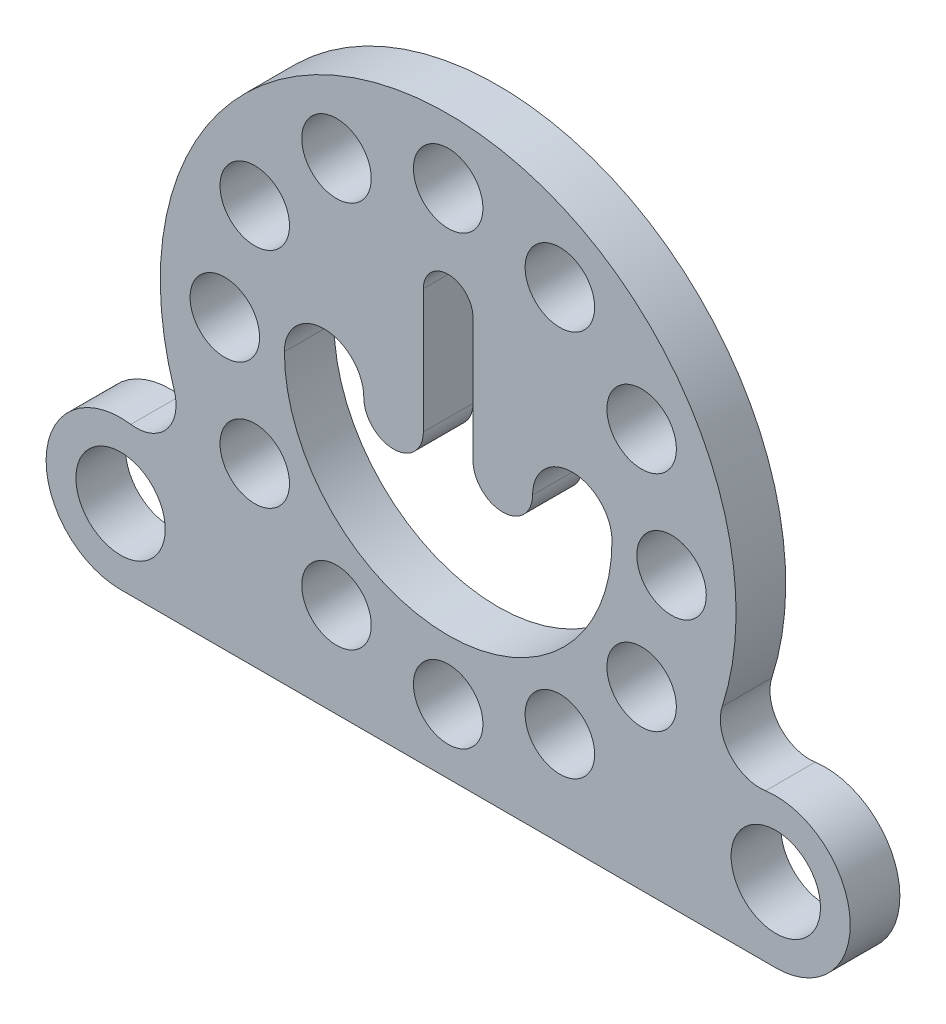
from build123d import *

# Parameters (mm, degrees)
CROQUIS1_R              = 58
CROQUIS1_R_2            = 7
CROQUIS1_R_3            = 9
SALIENTE_EXTRUIR1_DEPTH = 10


with BuildPart() as part:
    # Croquis1 → Saliente-Extruir1 (new body)
    # profile 1 of 3: a face of its own
    with BuildSketch(Plane.XY):
        Circle(CROQUIS1_R)
        with Locations((-22.5, 38.97114317)):
            Circle(CROQUIS1_R_2, mode=Mode.SUBTRACT)
        with Locations((-38.97114317, 22.5)):
            Circle(CROQUIS1_R_2, mode=Mode.SUBTRACT)
        with Locations((-45, 0)):
            Circle(CROQUIS1_R_2, mode=Mode.SUBTRACT)
        with Locations((-38.97114317, -22.5)):
            Circle(CROQUIS1_R_2, mode=Mode.SUBTRACT)
        with Locations((-22.5, -38.97114317)):
            Circle(CROQUIS1_R_2, mode=Mode.SUBTRACT)
        with Locations((0, -45)):
            Circle(CROQUIS1_R_2, mode=Mode.SUBTRACT)
        with Locations((22.5, -38.97114317)):
            Circle(CROQUIS1_R_2, mode=Mode.SUBTRACT)
        with Locations((38.97114317, -22.5)):
            Circle(CROQUIS1_R_2, mode=Mode.SUBTRACT)
        with Locations((45, 0)):
            Circle(CROQUIS1_R_2, mode=Mode.SUBTRACT)
        with Locations((38.97114317, 22.5)):
            Circle(CROQUIS1_R_2, mode=Mode.SUBTRACT)
        with Locations((22.5, 38.97114317)):
            Circle(CROQUIS1_R_2, mode=Mode.SUBTRACT)
        with Locations((0, 45)):
            Circle(CROQUIS1_R_2, mode=Mode.SUBTRACT)
        with BuildLine():
            Line((5, 25), (5, 0))
            ThreePointArc((5, 0), (11, -6), (17, 0))
            ThreePointArc((17, 0), (25, 8), (33, 0))
            ThreePointArc((33, 0), (0, -33), (-33, 0))
            ThreePointArc((-33, 0), (-25, 8), (-17, 0))
            ThreePointArc((-17, 0), (-11, -6), (-5, 0))
            Line((-5, 0), (-5, 25))
            ThreePointArc((-5, 25), (0, 30), (5, 25))
        make_face(mode=Mode.SUBTRACT)
    # profile 2 of 3: a face of its own
    with BuildSketch(Plane.XY):
        with BuildLine():
            Line((1.58e-07, -58), (66, -58))
            ThreePointArc((66, -58), (80.964085993, -41.962632957), (63.930233382, -28.143484051))
            ThreePointArc((63.930233382, -28.143484051), (56.702087905, -25.367174857), (55.211041749, -17.769098711))
            ThreePointArc((55.211041749, -17.769098711), (34.156934021, -46.87540782), (1.58e-07, -58))
        make_face()
        with Locations((66, -43)):
            Circle(CROQUIS1_R_3, mode=Mode.SUBTRACT)
    # profile 3 of 3: a face of its own
    with BuildSketch(Plane.XY):
        with BuildLine():
            Line((-66, -58), (1.58e-07, -58))
            ThreePointArc((1.58e-07, -58), (-34.156933894, -46.875407913), (-55.211041749, -17.769098711))
            ThreePointArc((-55.211041749, -17.769098711), (-56.702087905, -25.367174857), (-63.930233382, -28.143484051))
            ThreePointArc((-63.930233382, -28.143484051), (-80.964085993, -41.962632957), (-66, -58))
        make_face()
        with Locations((-66, -43)):
            Circle(CROQUIS1_R_3, mode=Mode.SUBTRACT)
    extrude(amount=SALIENTE_EXTRUIR1_DEPTH)


solid = part.part
